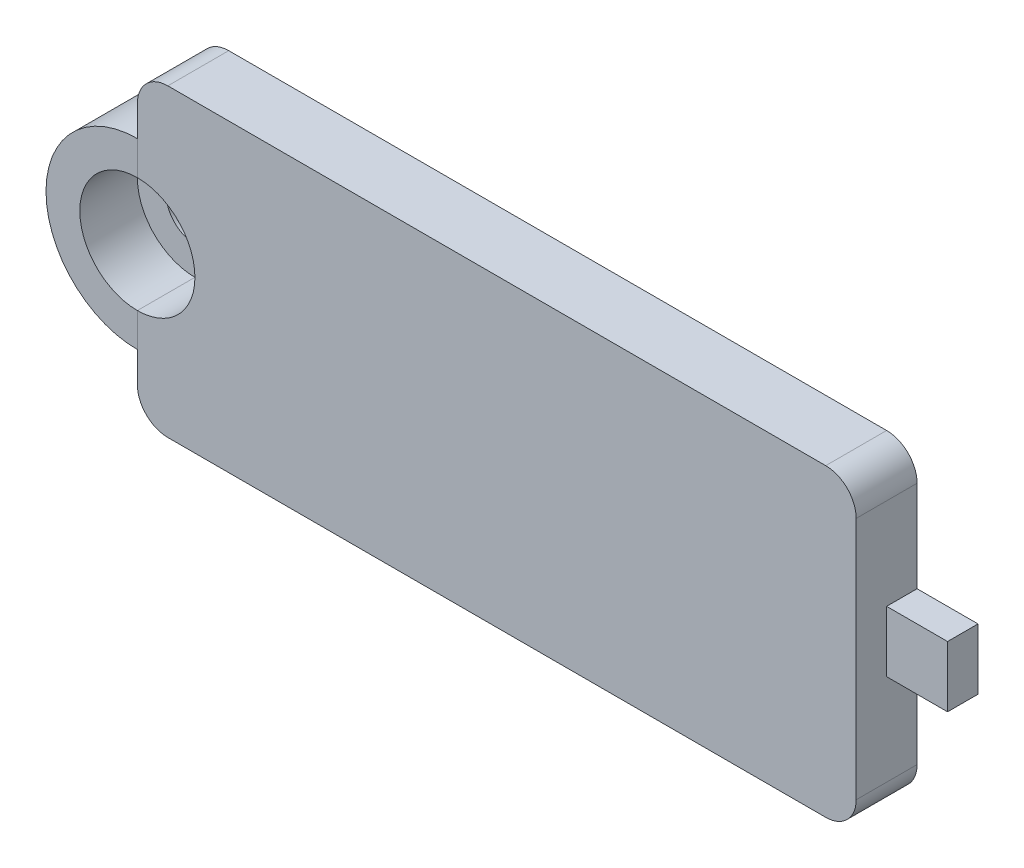
from build123d import *

# Parameters (mm, degrees)
SKETCH1_W           = 37.465
SKETCH1_H           = 15.875
BOSS_EXTRUDE1_DEPTH = 3.175
BOSS_EXTRUDE2_DEPTH = 3.175
FILLET2_R           = 1.5875
SKETCH5_W           = 3.175
SKETCH5_H           = 3.175
BOSS_EXTRUDE3_DEPTH = 1.5875


with BuildPart() as part:
    # Sketch1 → Boss-Extrude1 (new body)
    with BuildSketch(Plane.XY):
        Rectangle(SKETCH1_W, SKETCH1_H)
    extrude(amount=BOSS_EXTRUDE1_DEPTH)


with BuildPart() as body_2:
    # Sketch2 → Boss-Extrude2 (new body)
    with BuildSketch(Plane.XY.offset(3.175)):
        with BuildLine():
            Line((-18.7325, 4.7625), (-18.7325, -4.7625))
            ThreePointArc((-18.7325, -4.7625), (-23.495, 0), (-18.7325, 4.7625))
        make_face()
    extrude(amount=-BOSS_EXTRUDE2_DEPTH)


with BuildPart() as cbore_for_00_binding_head_machine_screw_tool:
    # Sketch4 → CBORE for #00 Binding Head Machine Screw1 (revolve)
    with BuildSketch(Plane(origin=(-18.7325, 0, 3.175), x_dir=(0, -1, 0), z_dir=(1, 0, 0))):
        Polygon((0, 0), (0, 3.175), (1.500000048, 3.175), (1.500000048, 3.000000096), (2.999999969, 3.000000096), (2.999999969, 0), align=None)
    revolve(axis=Axis((-18.7325, 0, 9.525), (0, 0, -1)))


with BuildPart() as part_1:
    add(part.part)

    # CBORE for #00 Binding Head Machine Screw1: cut by cbore_for_00_binding_head_machine_screw_tool
    add(cbore_for_00_binding_head_machine_screw_tool.part, mode=Mode.SUBTRACT)

    # Fillet2
    fillet2_edges = [part_1.edges().sort_by_distance(p)[0] for p in [
        (18.7325, -7.9375, 1.5875),
        (-18.7325, -7.9375, 1.5875),
        (-18.7325, 7.9375, 1.5875),
        (18.7325, 7.9375, 1.5875),
    ]]
    fillet(fillet2_edges, radius=FILLET2_R)

    # Sketch5 → Boss-Extrude3 (add)
    with BuildSketch(Plane(origin=(0, 0, 0), x_dir=(-1, 0, 0), z_dir=(0, 0, -1))):
        with Locations((-20.32, 0)):
            Rectangle(SKETCH5_W, SKETCH5_H)
    extrude(amount=-BOSS_EXTRUDE3_DEPTH)


with BuildPart() as body_2_1:
    add(body_2.part)

    # CBORE for #00 Binding Head Machine Screw1: cut by cbore_for_00_binding_head_machine_screw_tool
    add(cbore_for_00_binding_head_machine_screw_tool.part, mode=Mode.SUBTRACT)


solid = Compound([part_1.part, body_2_1.part])
